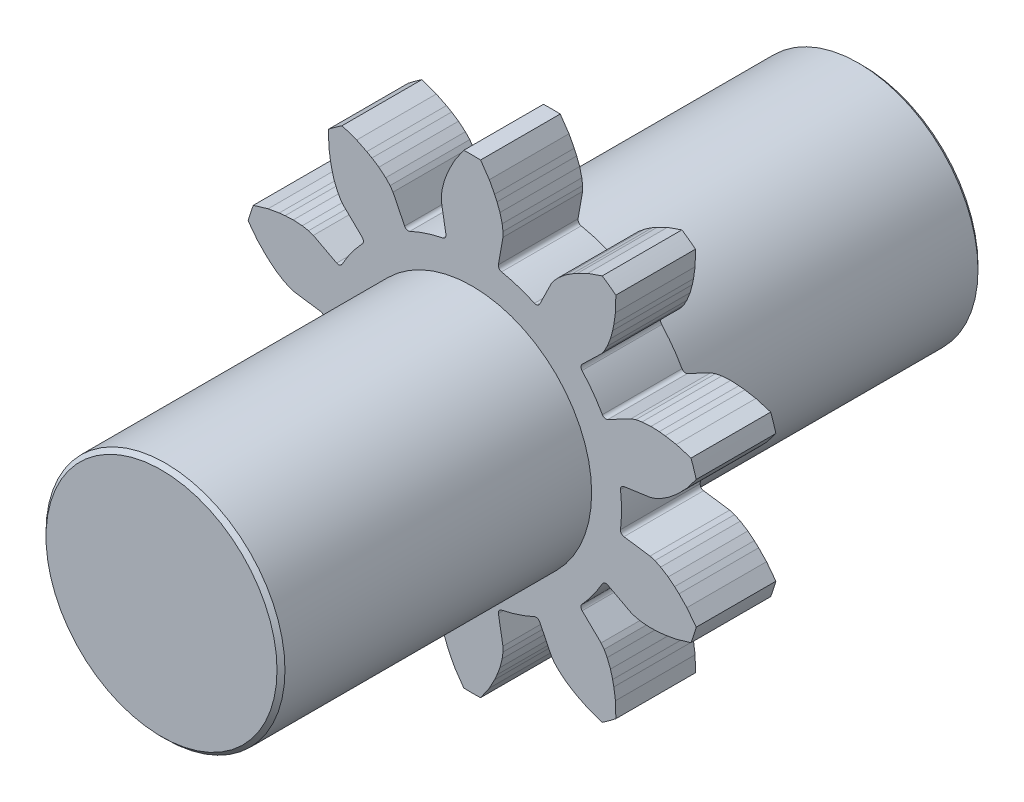
from build123d import *

# Parameters (mm, degrees)
ESQUISSE1_R                  = 29.25
BASE_EXTRUSION_DEPTH         = 10
ENL_V_MAT_EXTRU_1_DEPTH      = 43.557314295
R_P_TITION_CIRCULAIRE1_COUNT = 10
BOSS_EXTRU_1_DEPTH           = 39
BOSS_EXTRU_1_DEPTH_BACK      = 49
ESQUISSE3_R                  = 15
CHANFREIN1_SIZE              = 0.5


with BuildPart() as part:
    # Esquisse1 → Base-Extrusion (new body)
    with BuildSketch(Plane.XY):
        Circle(ESQUISSE1_R)
    extrude(amount=BASE_EXTRUSION_DEPTH)

    # Esquisse2 → Enlèv. mat.-Extru.1 (cut, through all)
    with BuildSketch(Plane.XY.offset(10)):
        with BuildLine():
            Line((1.054857226, 29.230972892), (2.153979018, 27.637740977))
            Line((2.153979018, 27.637740977), (2.813735508, 26.385915302))
            Line((2.813735508, 26.385915302), (3.118975564, 25.704109438))
            Line((3.118975564, 25.704109438), (3.489848129, 24.737353775))
            Line((3.489848129, 24.737353775), (3.627156031, 24.194659923))
            Line((3.627156031, 24.194659923), (3.764463933, 23.65196607))
            Line((3.764463933, 23.65196607), (3.867987042, 22.85898519))
            Line((3.867987042, 22.85898519), (3.859597952, 22.219907814))
            Line((3.859597952, 22.219907814), (3.70756595, 21.344651606))
            Line((3.70756595, 21.344651606), (3.293284083, 18.959609172))
            ThreePointArc((3.293284083, 18.959609172), (3.373360073, 18.591543583), (3.687572402, 18.383805639))
            ThreePointArc((3.687572402, 18.383805639), (5.794068645, 17.832309681), (7.822421094, 17.040311858))
            ThreePointArc((7.822421094, 17.040311858), (8.198729509, 17.023686012), (8.47985587, 17.274389842))
            Line((8.47985587, 17.274389842), (9.546587568, 19.447438475))
            Line((9.546587568, 19.447438475), (9.938053786, 20.244897791))
            Line((9.938053786, 20.244897791), (10.306907126, 20.766853232))
            Line((10.306907126, 20.766853232), (10.856761548, 21.347538884))
            Line((10.856761548, 21.347538884), (11.286833417, 21.705879873))
            Line((11.286833417, 21.705879873), (11.716905285, 22.064220863))
            Line((11.716905285, 22.064220863), (12.585192214, 22.628349199))
            Line((12.585192214, 22.628349199), (13.232892039, 23.000526127))
            Line((13.232892039, 23.000526127), (14.502450922, 23.625479237))
            Line((14.502450922, 23.625479237), (16.328137354, 24.268383353))
            ThreePointArc((16.328137354, 24.268383353), (9.038747085, 27.818403102), (1.054857226, 29.230972892))
        make_face()
    enl_v_mat_extru_1 = extrude(amount=-ENL_V_MAT_EXTRU_1_DEPTH, mode=Mode.SUBTRACT)

    # Répétition circulaire1: Enlèv. mat.-Extru.1 ×10 about axis
    r_p_tition_circulaire1_axis = Axis((0, 0, -50), (0, 0, 1))
    for i in range(1, R_P_TITION_CIRCULAIRE1_COUNT):
        add(enl_v_mat_extru_1.rotate(r_p_tition_circulaire1_axis, i * 360 / R_P_TITION_CIRCULAIRE1_COUNT), mode=Mode.SUBTRACT)

    # Esquisse3 → Boss.-Extru.1 (add, two sides: drawn at the far end of the back side and taken through both)
    with BuildSketch(Plane.XY.offset(10).offset(-BOSS_EXTRU_1_DEPTH_BACK)):
        Circle(ESQUISSE3_R)
    extrude(amount=BOSS_EXTRU_1_DEPTH + BOSS_EXTRU_1_DEPTH_BACK)

    # Chanfrein1
    chanfrein1_edges = [part.edges().sort_by_distance(p)[0] for p in [
        (-15, 0, -39),
        (-15, 0, 49),
    ]]
    chamfer(chanfrein1_edges, length=CHANFREIN1_SIZE)


solid = part.part
